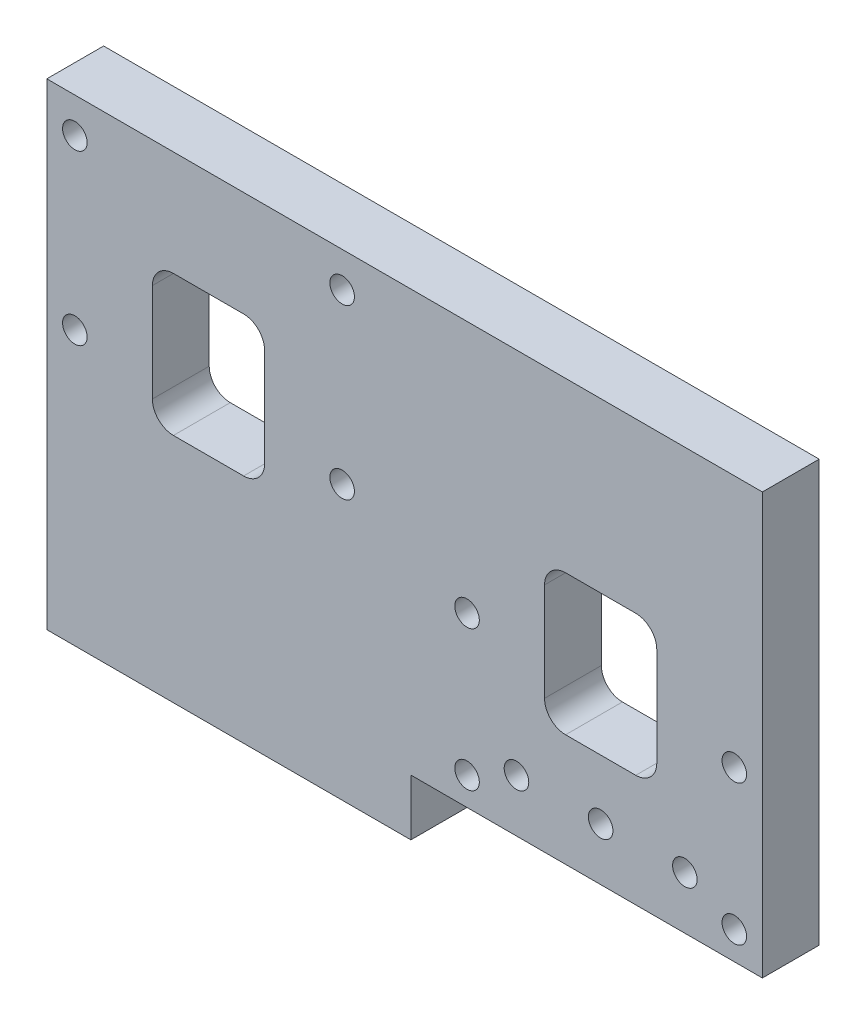
from build123d import *

# Parameters (mm, degrees)
ESQUISSE1_W             = 102
ESQUISSE1_H             = 60
BOSS_EXTRU_1_DEPTH      = 8.1
ESQUISSE2_R             = 1.75
ENL_V_MAT_EXTRU_1_DEPTH = 119.61538686
ESQUISSE5_W             = 51.9
ESQUISSE5_H             = 8
BOSS_EXTRU_2_DEPTH      = 8.1
ESQUISSE6_W             = 16
ESQUISSE6_H             = 20
ENL_V_MAT_EXTRU_2_DEPTH = 119.61538686
CONG_1_R                = 3


with BuildPart() as part:
    # Esquisse1 → Boss.-Extru.1 (new body)
    with BuildSketch(Plane.XY):
        with Locations((51, 30)):
            Rectangle(ESQUISSE1_W, ESQUISSE1_H)
    extrude(amount=BOSS_EXTRU_1_DEPTH)

    # Esquisse2 → Enlèv. mat.-Extru.1 (cut, through all)
    with BuildSketch(Plane.XY.offset(8.1)):
        with Locations((4, 55)):
            Circle(ESQUISSE2_R)
        with Locations((4, 31)):
            Circle(ESQUISSE2_R)
        with Locations((98, 24)):
            Circle(ESQUISSE2_R)
        with Locations((98, 4)):
            Circle(ESQUISSE2_R)
        with Locations(Location((59.9, 4, 0), (0, 0, 180))):
            Circle(ESQUISSE2_R)
        with Locations(Location((59.9, 24, 0), (0, 0, 180))):
            Circle(ESQUISSE2_R)
        with Locations(Location((42.1, 31, 0), (0, 0, 180))):
            Circle(ESQUISSE2_R)
        with Locations(Location((42.1, 55, 0), (0, 0, 180))):
            Circle(ESQUISSE2_R)
        with Locations((66.95, 7.5)):
            Circle(ESQUISSE2_R)
        with Locations((78.95, 7.5)):
            Circle(ESQUISSE2_R)
        with Locations(Location((90.95, 7.5, 0), (0, 0, 180))):
            Circle(ESQUISSE2_R)
    extrude(amount=-ENL_V_MAT_EXTRU_1_DEPTH, mode=Mode.SUBTRACT)

    # Esquisse5 → Boss.-Extru.2 (add)
    with BuildSketch(Plane.XY.offset(8.1)):
        with Locations((25.95, -4)):
            Rectangle(ESQUISSE5_W, ESQUISSE5_H)
    extrude(amount=-BOSS_EXTRU_2_DEPTH)

    # Esquisse6 → Enlèv. mat.-Extru.2 (cut, through all)
    with BuildSketch(Plane.XY.offset(8.1)):
        with Locations((23.05, 35)):
            Rectangle(ESQUISSE6_W, ESQUISSE6_H)
        with Locations((78.95, 26)):
            Rectangle(ESQUISSE6_W, ESQUISSE6_H)
    extrude(amount=-ENL_V_MAT_EXTRU_2_DEPTH, mode=Mode.SUBTRACT)

    # Congé1
    cong_1_edges = [part.edges().sort_by_distance(p)[0] for p in [
        (15.05, 25, 4.05),
        (15.05, 45, 4.05),
        (31.05, 45, 4.05),
        (31.05, 25, 4.05),
        (86.95, 36, 4.05),
        (86.95, 16, 4.05),
        (70.95, 16, 4.05),
        (70.95, 36, 4.05),
    ]]
    fillet(cong_1_edges, radius=CONG_1_R)


solid = part.part
